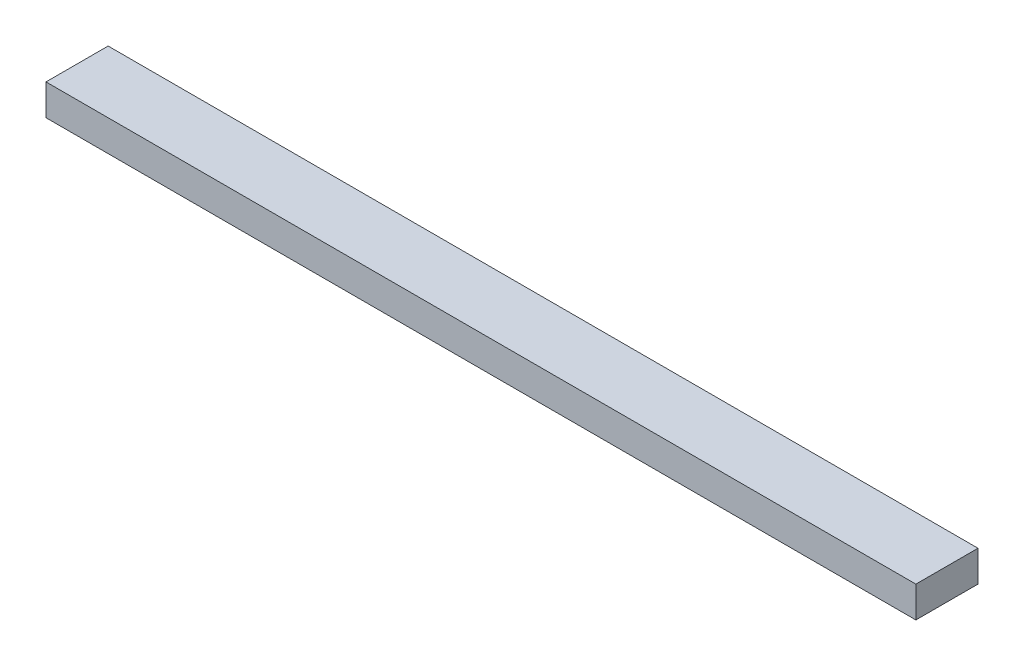
from build123d import *

# Parameters (mm, degrees)
ESQUISSE1_W        = 280
ESQUISSE1_H        = 10
BOSS_EXTRU_1_DEPTH = 20


with BuildPart() as part:
    # Esquisse1 → Boss.-Extru.1 (new body)
    with BuildSketch(Plane.XY):
        with Locations((38.001827175, 21.357543737)):
            Rectangle(ESQUISSE1_W, ESQUISSE1_H)
    extrude(amount=BOSS_EXTRU_1_DEPTH)


solid = part.part
